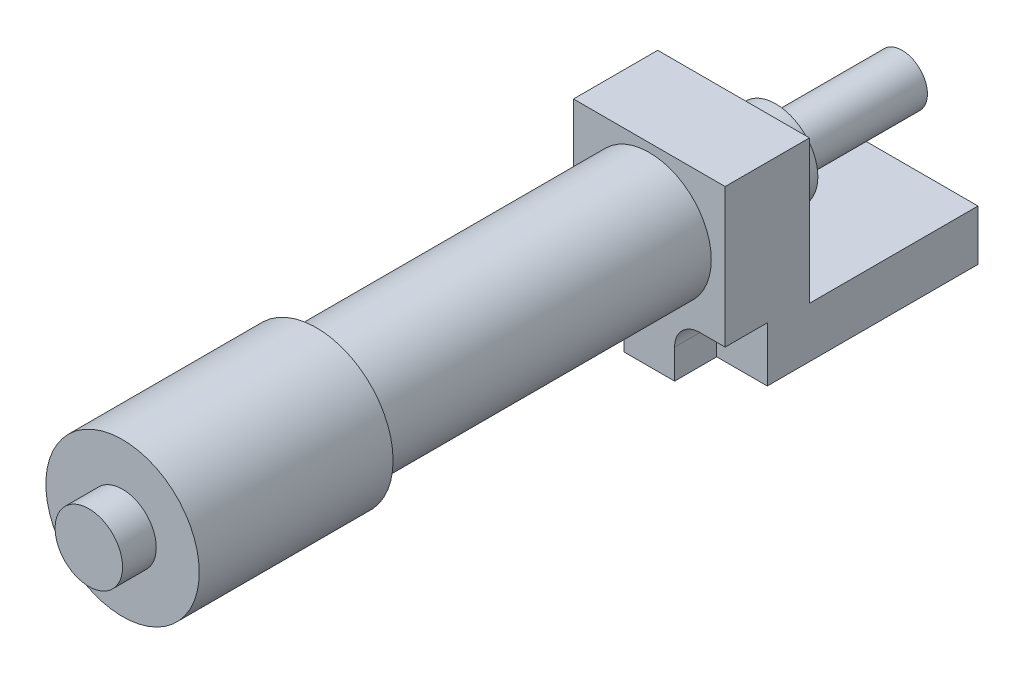
from build123d import *

# Parameters (mm, degrees)
BOSS_EXTRUDE1_DEPTH = 18
CUT_EXTRUDE1_DEPTH  = 5
SKETCH4_R           = 5
BOSS_EXTRUDE2_DEPTH = 5
SKETCH5_R           = 3
BOSS_EXTRUDE3_DEPTH = 15
SKETCH6_R           = 7.35
BOSS_EXTRUDE4_DEPTH = 39.5
SKETCH7_R           = 9.1
BOSS_EXTRUDE5_DEPTH = 23
SKETCH8_R           = 4
BOSS_EXTRUDE6_DEPTH = 4


with BuildPart() as part:
    # Sketch1 → Boss-Extrude1 (new body)
    with BuildSketch(Plane(origin=(0, 0, 0), x_dir=(0, 0, -1), z_dir=(1, 0, 0))):
        Polygon((0, 0), (30, 0), (30, 6), (10, 6), (10, 23), (0, 23), align=None)
    extrude(amount=BOSS_EXTRUDE1_DEPTH)

    # Sketch2 → Cut-Extrude1 (cut)
    with BuildSketch(Plane.XY):
        with BuildLine():
            Line((12, 0), (12, 3.5))
            ThreePointArc((12, 3.5), (12.878679656, 5.621320344), (15, 6.5))
            Line((15, 6.5), (18, 6.5))
            Line((18, 6.5), (18, 0))
            Line((18, 0), (12, 0))
        make_face()
        with BuildLine():
            Line((6, 0), (6, 3.5))
            ThreePointArc((6, 3.5), (5.121320344, 5.621320344), (3, 6.5))
            Line((3, 6.5), (0, 6.5))
            Line((0, 6.5), (0, 0))
            Line((0, 0), (6, 0))
        make_face()
    extrude(amount=-CUT_EXTRUDE1_DEPTH, mode=Mode.SUBTRACT)

    # Sketch4 → Boss-Extrude2 (add)
    with BuildSketch(Plane(origin=(0, 0, -10), x_dir=(-1, 0, 0), z_dir=(0, 0, -1))):
        with Locations(Location((-9, 14.5, 0), (0, 0, 270))):
            Circle(SKETCH4_R)
    extrude(amount=BOSS_EXTRUDE2_DEPTH)

    # Sketch5 → Boss-Extrude3 (add)
    with BuildSketch(Plane(origin=(0, 0, -15), x_dir=(-1, 0, 0), z_dir=(0, 0, -1))):
        with Locations(Location((-9, 14.5, 0), (0, 0, 90))):
            Circle(SKETCH5_R)
    extrude(amount=BOSS_EXTRUDE3_DEPTH)

    # Sketch6 → Boss-Extrude4 (add)
    with BuildSketch(Plane.XY):
        with Locations((9, 14.65)):
            Circle(SKETCH6_R)
    extrude(amount=BOSS_EXTRUDE4_DEPTH)

    # Sketch7 → Boss-Extrude5 (add)
    with BuildSketch(Plane.XY.offset(39.5)):
        with Locations((9, 14.65)):
            Circle(SKETCH7_R)
    extrude(amount=BOSS_EXTRUDE5_DEPTH)

    # Sketch8 → Boss-Extrude6 (add)
    with BuildSketch(Plane.XY.offset(62.5)):
        with Locations((9, 14.65)):
            Circle(SKETCH8_R)
    extrude(amount=BOSS_EXTRUDE6_DEPTH)


solid = part.part
